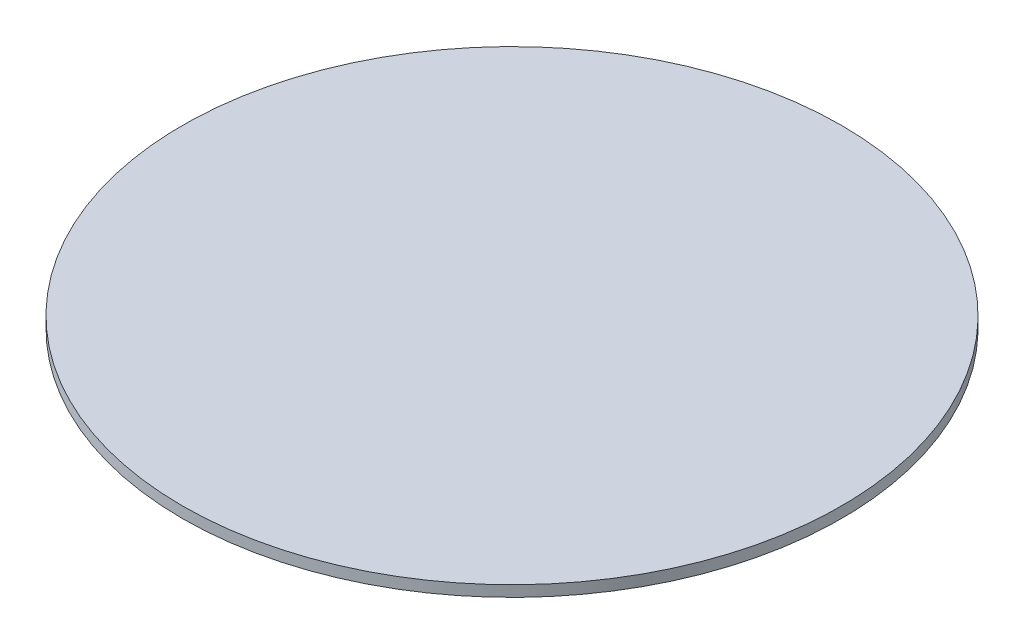
from build123d import *

# Parameters (mm, degrees)
SKETCH_1_R      = 6
EXTRUDE_1_DEPTH = 0.2


with BuildPart() as part:
    # 草图1 → 凸台-拉伸1 (new body)
    with BuildSketch(Plane(origin=(0, 0, 0), x_dir=(1, 0, 0), z_dir=(0, 1, 0))):
        with Locations(Location((0, 0, 0), (0, 0, 270))):
            Circle(SKETCH_1_R)
    extrude(amount=EXTRUDE_1_DEPTH)


solid = part.part
